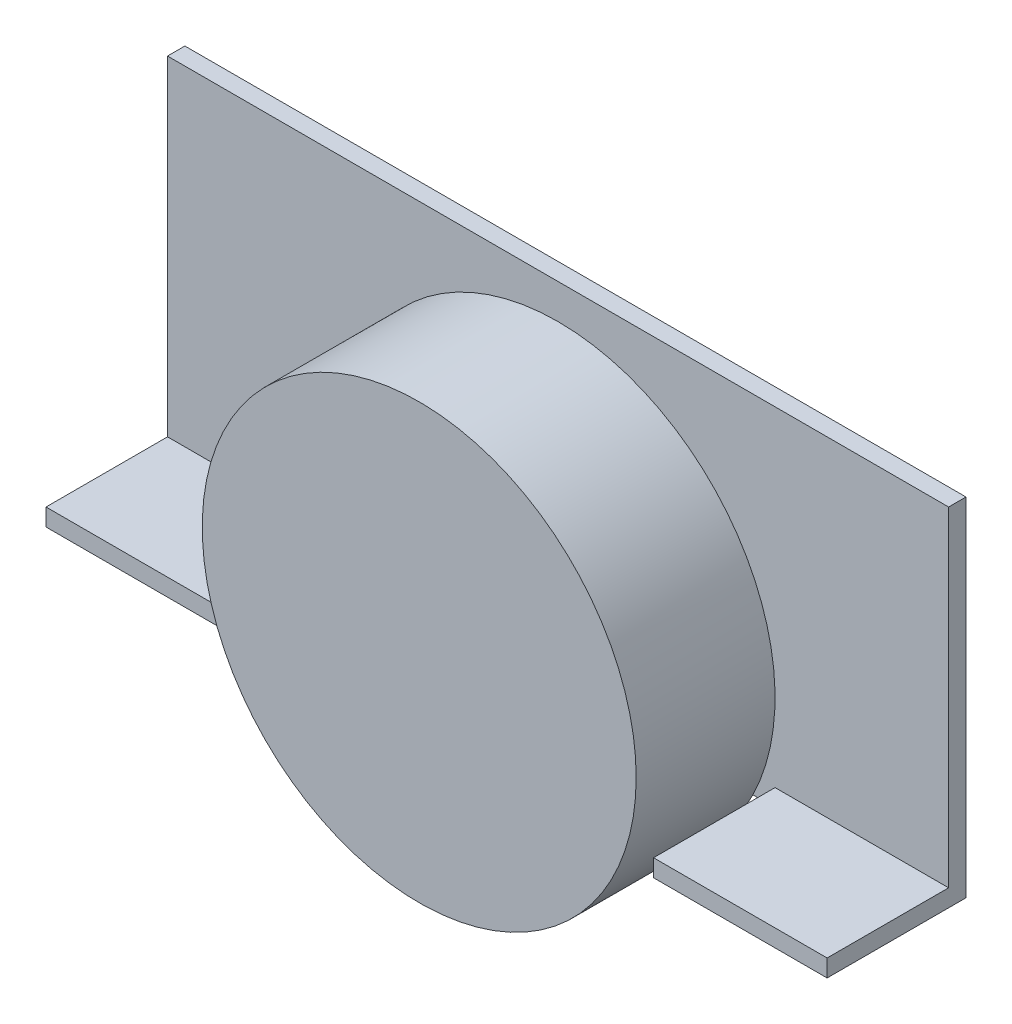
from build123d import *

# Parameters (mm, degrees)
SKETCH2_W           = 45
SKETCH2_H           = 20
BOSS_EXTRUDE1_DEPTH = 1
SKETCH3_R           = 12.5
BOSS_EXTRUDE4_DEPTH = 8
SKETCH6_W           = 10
SKETCH6_H           = 1
BOSS_EXTRUDE5_DEPTH = 7


with BuildPart() as part:
    # Sketch2 → Boss-Extrude1 (new body)
    with BuildSketch(Plane.XY):
        with Locations((22.5, 10)):
            Rectangle(SKETCH2_W, SKETCH2_H)
    extrude(amount=BOSS_EXTRUDE1_DEPTH)

    # Sketch3 → Boss-Extrude4 (add)
    with BuildSketch(Plane.XY.offset(1)):
        with Locations(Location((22.5, 5.5, 0), (0, 0, 206.103881137))):
            Circle(SKETCH3_R)
    extrude(amount=BOSS_EXTRUDE4_DEPTH)

    # Sketch6 → Boss-Extrude5 (add)
    with BuildSketch(Plane.XY.offset(1)):
        with Locations((5, 0.5)):
            Rectangle(SKETCH6_W, SKETCH6_H)
        with Locations((40, 0.5)):
            Rectangle(SKETCH6_W, SKETCH6_H)
    extrude(amount=BOSS_EXTRUDE5_DEPTH)


solid = part.part
